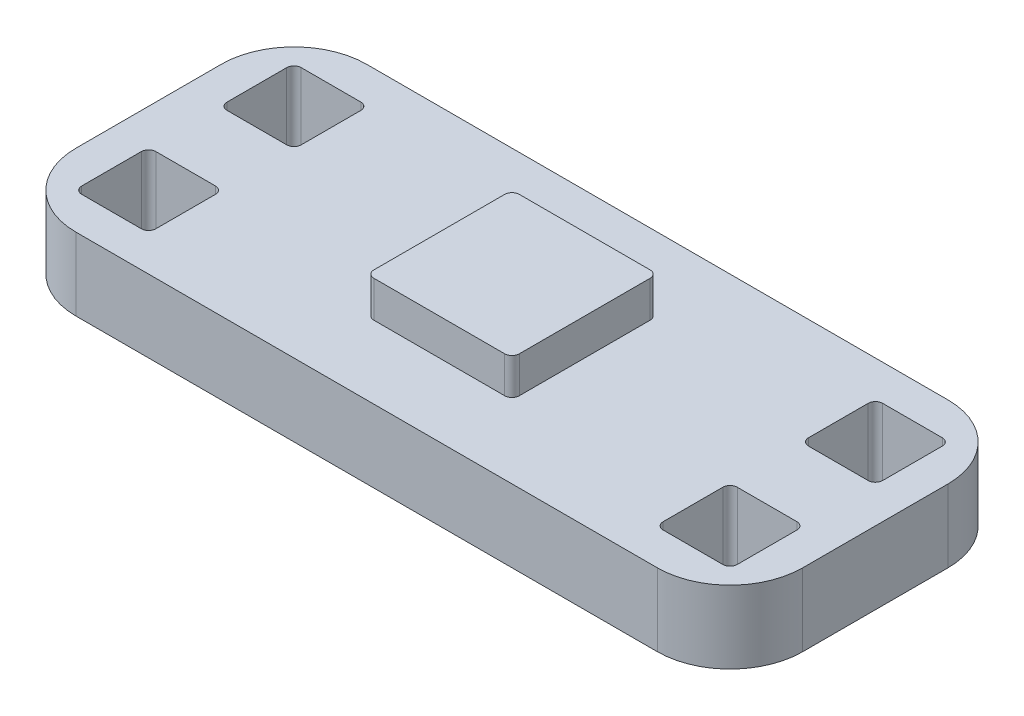
from build123d import *

# Parameters (mm, degrees)
SKETCH_1_W      = 100
SKETCH_1_H      = 40
EXTRUDE_1_DEPTH = 10
FILLET_1_R      = 10
EXTRUDE_2_DEPTH = 5


with BuildPart() as part:
    # ｽｹｯﾁ1 → ﾎﾞｽ - 押し出し1 (new body)
    with BuildSketch(Plane(origin=(0, 0, 0), x_dir=(1, 0, 0), z_dir=(0, 1, 0))):
        Rectangle(SKETCH_1_W, SKETCH_1_H)
        with BuildLine():
            Line((44.1, 15.1), (35.9, 15.1))
            ThreePointArc((35.9, 15.1), (35.192893219, 14.807106781), (34.9, 14.1))
            Line((34.9, 14.1), (34.9, 5.9))
            ThreePointArc((34.9, 5.9), (35.192893219, 5.192893219), (35.9, 4.9))
            Line((35.9, 4.9), (44.1, 4.9))
            ThreePointArc((44.1, 4.9), (44.807106781, 5.192893219), (45.1, 5.9))
            Line((45.1, 5.9), (45.1, 14.1))
            ThreePointArc((45.1, 14.1), (44.807106781, 14.807106781), (44.1, 15.1))
        make_face(mode=Mode.SUBTRACT)
        with BuildLine():
            Line((-44.1, 4.9), (-35.9, 4.9))
            ThreePointArc((-35.9, 4.9), (-35.192893219, 5.192893219), (-34.9, 5.9))
            Line((-34.9, 5.9), (-34.9, 14.1))
            ThreePointArc((-34.9, 14.1), (-35.192893219, 14.807106781), (-35.9, 15.1))
            Line((-35.9, 15.1), (-44.1, 15.1))
            ThreePointArc((-44.1, 15.1), (-44.807106781, 14.807106781), (-45.1, 14.1))
            Line((-45.1, 14.1), (-45.1, 5.9))
            ThreePointArc((-45.1, 5.9), (-44.807106781, 5.192893219), (-44.1, 4.9))
        make_face(mode=Mode.SUBTRACT)
        with BuildLine():
            Line((45.1, -5.9), (45.1, -14.1))
            ThreePointArc((45.1, -14.1), (44.807106781, -14.807106781), (44.1, -15.1))
            Line((44.1, -15.1), (35.9, -15.1))
            ThreePointArc((35.9, -15.1), (35.192893219, -14.807106781), (34.9, -14.1))
            Line((34.9, -14.1), (34.9, -5.9))
            ThreePointArc((34.9, -5.9), (35.192893219, -5.192893219), (35.9, -4.9))
            Line((35.9, -4.9), (44.1, -4.9))
            ThreePointArc((44.1, -4.9), (44.807106781, -5.192893219), (45.1, -5.9))
        make_face(mode=Mode.SUBTRACT)
        with BuildLine():
            Line((-44.1, -15.1), (-35.9, -15.1))
            ThreePointArc((-35.9, -15.1), (-35.192893219, -14.807106781), (-34.9, -14.1))
            Line((-34.9, -14.1), (-34.9, -5.9))
            ThreePointArc((-34.9, -5.9), (-35.192893219, -5.192893219), (-35.9, -4.9))
            Line((-35.9, -4.9), (-44.1, -4.9))
            ThreePointArc((-44.1, -4.9), (-44.807106781, -5.192893219), (-45.1, -5.9))
            Line((-45.1, -5.9), (-45.1, -14.1))
            ThreePointArc((-45.1, -14.1), (-44.807106781, -14.807106781), (-44.1, -15.1))
        make_face(mode=Mode.SUBTRACT)
    extrude(amount=EXTRUDE_1_DEPTH)

    # ﾌｨﾚｯﾄ1
    fillet_1_edges = [part.edges().sort_by_distance(p)[0] for p in [
        (50, 5, 20),
        (-50, 5, 20),
        (-50, 5, -20),
        (50, 5, -20),
    ]]
    fillet(fillet_1_edges, radius=FILLET_1_R)

    # ｽｹｯﾁ2 → ﾎﾞｽ - 押し出し2 (add)
    with BuildSketch(Plane(origin=(0, 10, 0), x_dir=(1, 0, 0), z_dir=(0, 1, 0))):
        with BuildLine():
            Line((-9, -10), (9, -10))
            ThreePointArc((9, -10), (9.707106781, -9.707106781), (10, -9))
            Line((10, -9), (10, 9))
            ThreePointArc((10, 9), (9.707106781, 9.707106781), (9, 10))
            Line((9, 10), (-9, 10))
            ThreePointArc((-9, 10), (-9.707106781, 9.707106781), (-10, 9))
            Line((-10, 9), (-10, -9))
            ThreePointArc((-10, -9), (-9.707106781, -9.707106781), (-9, -10))
        make_face()
    extrude(amount=EXTRUDE_2_DEPTH)


solid = part.part
